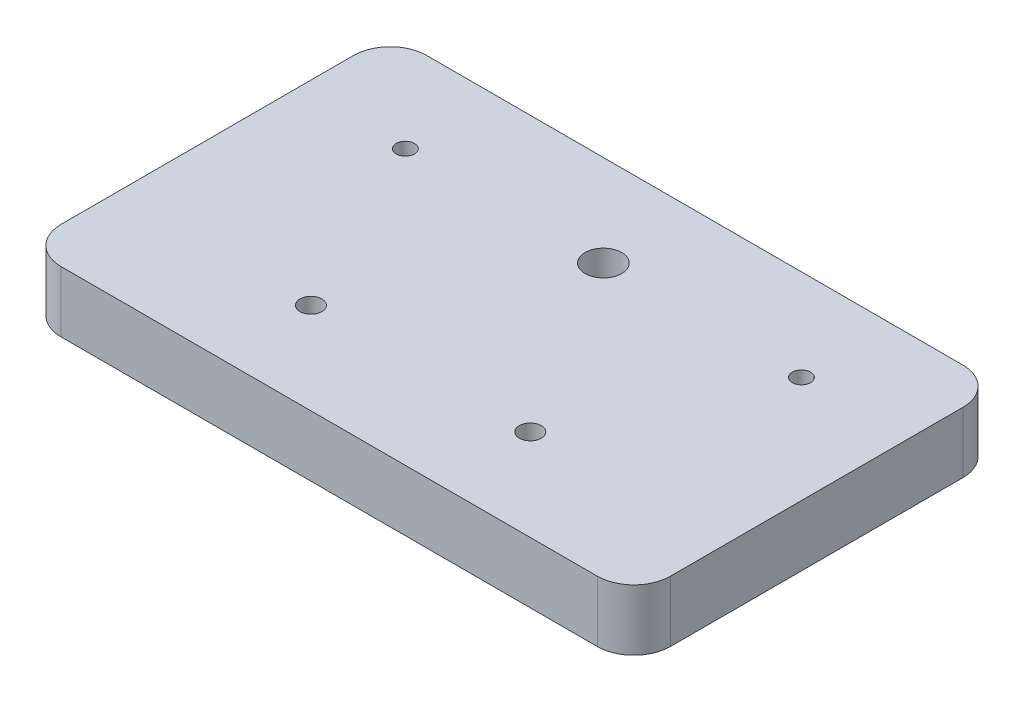
from build123d import *

# Parameters (mm, degrees)
SKETCH1_W                      = 100
SKETCH1_H                      = 60
BOSS_EXTRUDE1_DEPTH            = 10
CBORE_FOR_M3_SHCS1_D           = 3.6
CBORE_FOR_M3_SHCS1_CBORE_D     = 6.5
CBORE_FOR_M3_SHCS1_CBORE_DEPTH = 3
CUT_EXTRUDE1_REACH             = 61.161
SKETCH5_R                      = 3
SKETCH5_R_2                    = 1.5
FILLET1_R                      = 6


with BuildPart() as part:
    # Sketch1 → Boss-Extrude1 (new body)
    with BuildSketch(Plane(origin=(0, 0, 0), x_dir=(1, 0, 0), z_dir=(0, 1, 0))):
        Rectangle(SKETCH1_W, SKETCH1_H)
    extrude(amount=BOSS_EXTRUDE1_DEPTH)

    # CBORE for M3 SHCS1 (through all)
    with Locations(Plane(origin=(0, 0, 0), x_dir=(-1, 0, 0), z_dir=(0, -1, 0))):
        with Locations((-18, -15), (18, -15)):
            CounterBoreHole(CBORE_FOR_M3_SHCS1_D / 2, CBORE_FOR_M3_SHCS1_CBORE_D / 2, CBORE_FOR_M3_SHCS1_CBORE_DEPTH)

    # Sketch5 → Cut-Extrude1 (cut, up to next)
    with BuildSketch(Plane(origin=(0, 0, 0), x_dir=(-1, 0, 0), z_dir=(0, -1, 0)), mode=Mode.PRIVATE) as cut_extrude1_sk1:
        with Locations(Location((0, 15, 0), (0, 0, 90))):
            Circle(SKETCH5_R)
    cut_extrude1_tool1 = extrude(cut_extrude1_sk1.sketch, amount=-CUT_EXTRUDE1_REACH, mode=Mode.PRIVATE) & part.part
    # Sketch5 → Cut-Extrude1 (cut, up to next)
    with BuildSketch(Plane(origin=(0, 0, 0), x_dir=(-1, 0, 0), z_dir=(0, -1, 0)), mode=Mode.PRIVATE) as cut_extrude1_sk2:
        with Locations(Location((32.5, 15, 0), (0, 0, 90))):
            Circle(SKETCH5_R_2)
    cut_extrude1_tool2 = extrude(cut_extrude1_sk2.sketch, amount=-CUT_EXTRUDE1_REACH, mode=Mode.PRIVATE) & part.part
    # Sketch5 → Cut-Extrude1 (cut, up to next)
    with BuildSketch(Plane(origin=(0, 0, 0), x_dir=(-1, 0, 0), z_dir=(0, -1, 0)), mode=Mode.PRIVATE) as cut_extrude1_sk3:
        with Locations(Location((-32.5, 15, 0), (0, 0, 90))):
            Circle(SKETCH5_R_2)
    cut_extrude1_tool3 = extrude(cut_extrude1_sk3.sketch, amount=-CUT_EXTRUDE1_REACH, mode=Mode.PRIVATE) & part.part
    add(cut_extrude1_tool1.solids().sort_by_distance((0, 0, -15))[0], mode=Mode.SUBTRACT)
    add(cut_extrude1_tool2.solids().sort_by_distance((-32.5, 0, -15))[0], mode=Mode.SUBTRACT)
    add(cut_extrude1_tool3.solids().sort_by_distance((32.5, 0, -15))[0], mode=Mode.SUBTRACT)

    # Fillet1
    fillet1_edges = [part.edges().sort_by_distance(p)[0] for p in [
        (50, 5, 30),
        (-50, 5, 30),
        (-50, 5, -30),
        (50, 5, -30),
    ]]
    fillet(fillet1_edges, radius=FILLET1_R)


solid = part.part
